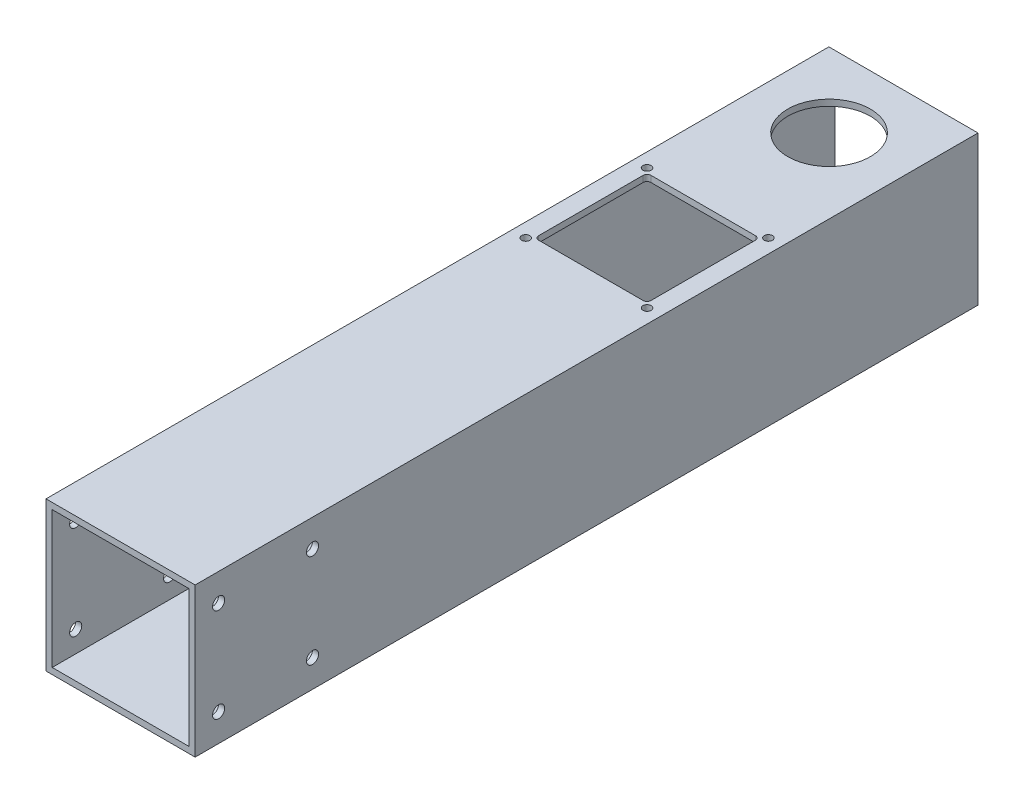
from build123d import *

# Parameters (mm, degrees)
SKETCH1_W           = 76.2
SKETCH1_H           = 76.2
SKETCH1_W_2         = 69.85
SKETCH1_H_2         = 69.85
BOSS_EXTRUDE1_DEPTH = 200
SKETCH4_R           = 3.1
CUT_EXTRUDE2_DEPTH  = 218.389167163
CUT_EXTRUDE3_REACH  = 219.389
SKETCH5_R           = 2.1
SKETCH5_W           = 57.4
SKETCH5_H           = 57.4
FILLET1_R           = 2
SKETCH6_R           = 21.1
CUT_EXTRUDE4_DEPTH  = 218.389167163


with BuildPart() as part:
    # Sketch1 → Boss-Extrude1 (new, symmetric)
    with BuildSketch(Plane.XY):
        Rectangle(SKETCH1_W, SKETCH1_H)
        Rectangle(SKETCH1_W_2, SKETCH1_H_2, mode=Mode.SUBTRACT)
    extrude(amount=BOSS_EXTRUDE1_DEPTH, both=True)

    # Sketch4 → Cut-Extrude2 (cut, through all)
    with BuildSketch(Plane(origin=(38.1, 0, 0), x_dir=(0, 0, -1), z_dir=(1, 0, 0))):
        with Locations((-140, 24)):
            Circle(SKETCH4_R)
        with Locations((-188, 24)):
            Circle(SKETCH4_R)
        with Locations((-140, -24)):
            Circle(SKETCH4_R)
        with Locations((-188, -24)):
            Circle(SKETCH4_R)
    extrude(amount=-CUT_EXTRUDE2_DEPTH, mode=Mode.SUBTRACT)

    # Sketch5 → Cut-Extrude3 (cut, up to next)
    with BuildSketch(Plane(origin=(0, 38.1, 0), x_dir=(1, 0, 0), z_dir=(0, 1, 0)), mode=Mode.PRIVATE) as cut_extrude3_sk1:
        with Locations(Location((31, 38, 0), (0, 0, 180))):
            Circle(SKETCH5_R)
    cut_extrude3_tool1 = extrude(cut_extrude3_sk1.sketch, amount=-CUT_EXTRUDE3_REACH, mode=Mode.PRIVATE) & part.part
    # Sketch5 → Cut-Extrude3 (cut, up to next)
    with BuildSketch(Plane(origin=(0, 38.1, 0), x_dir=(1, 0, 0), z_dir=(0, 1, 0)), mode=Mode.PRIVATE) as cut_extrude3_sk2:
        with Locations(Location((-31, 100, 0), (0, 0, 180))):
            Circle(SKETCH5_R)
    cut_extrude3_tool2 = extrude(cut_extrude3_sk2.sketch, amount=-CUT_EXTRUDE3_REACH, mode=Mode.PRIVATE) & part.part
    # Sketch5 → Cut-Extrude3 (cut, up to next)
    with BuildSketch(Plane(origin=(0, 38.1, 0), x_dir=(1, 0, 0), z_dir=(0, 1, 0)), mode=Mode.PRIVATE) as cut_extrude3_sk3:
        with Locations(Location((-31, 38, 0), (0, 0, 180))):
            Circle(SKETCH5_R)
    cut_extrude3_tool3 = extrude(cut_extrude3_sk3.sketch, amount=-CUT_EXTRUDE3_REACH, mode=Mode.PRIVATE) & part.part
    # Sketch5 → Cut-Extrude3 (cut, up to next)
    with BuildSketch(Plane(origin=(0, 38.1, 0), x_dir=(1, 0, 0), z_dir=(0, 1, 0)), mode=Mode.PRIVATE) as cut_extrude3_sk4:
        with Locations(Location((31, 100, 0), (0, 0, 180))):
            Circle(SKETCH5_R)
    cut_extrude3_tool4 = extrude(cut_extrude3_sk4.sketch, amount=-CUT_EXTRUDE3_REACH, mode=Mode.PRIVATE) & part.part
    # Sketch5 → Cut-Extrude3 (cut, up to next)
    with BuildSketch(Plane(origin=(0, 38.1, 0), x_dir=(1, 0, 0), z_dir=(0, 1, 0)), mode=Mode.PRIVATE) as cut_extrude3_sk5:
        with Locations((0, 69)):
            Rectangle(SKETCH5_W, SKETCH5_H)
    cut_extrude3_tool5 = extrude(cut_extrude3_sk5.sketch, amount=-CUT_EXTRUDE3_REACH, mode=Mode.PRIVATE) & part.part
    add(cut_extrude3_tool1.solids().sort_by_distance((31, 38.1, -38))[0], mode=Mode.SUBTRACT)
    add(cut_extrude3_tool2.solids().sort_by_distance((-31, 38.1, -100))[0], mode=Mode.SUBTRACT)
    add(cut_extrude3_tool3.solids().sort_by_distance((-31, 38.1, -38))[0], mode=Mode.SUBTRACT)
    add(cut_extrude3_tool4.solids().sort_by_distance((31, 38.1, -100))[0], mode=Mode.SUBTRACT)
    add(cut_extrude3_tool5.solids().sort_by_distance((0, 38.1, -69))[0], mode=Mode.SUBTRACT)

    # Fillet1
    fillet1_edges = [part.edges().sort_by_distance(p)[0] for p in [
        (28.7, 36.5125, -97.7),
        (-28.7, 36.5125, -97.7),
        (-28.7, 36.5125, -40.3),
        (28.7, 36.5125, -40.3),
    ]]
    fillet(fillet1_edges, radius=FILLET1_R)

    # Sketch6 → Cut-Extrude4 (cut, through all)
    with BuildSketch(Plane(origin=(0, 38.1, 0), x_dir=(1, 0, 0), z_dir=(0, 1, 0))):
        with Locations(Location((0, 162, 0), (0, 0, 180))):
            Circle(SKETCH6_R)
    extrude(amount=-CUT_EXTRUDE4_DEPTH, mode=Mode.SUBTRACT)


solid = part.part
